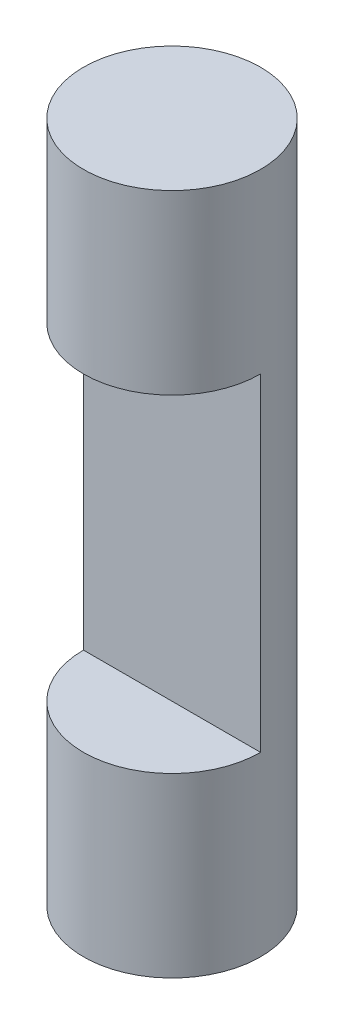
from build123d import *

# Parameters (mm, degrees)
SKETCH1_R           = 13
BOSS_EXTRUDE1_DEPTH = 1
SKETCH16_R          = 13
BOSS_EXTRUDE3_DEPTH = 1
SKETCH19_R          = 1
BOSS_EXTRUDE4_DEPTH = 29.8
SKETCH18_W          = 22
SKETCH18_H          = 22
CUT_EXTRUDE6_DEPTH  = 3.7
SKETCH21_R          = 11
CUT_EXTRUDE7_DEPTH  = 3.7
SKETCH22_R          = 11
CUT_EXTRUDE8_DEPTH  = 3.7
SKETCH23_R          = 11
CUT_EXTRUDE9_DEPTH  = 3.7
SKETCH24_R          = 19.921792127
CUT_EXTRUDE10_DEPTH = 1
SKETCH25_R          = 36.182885583
CUT_EXTRUDE11_DEPTH = 1
BOSS_EXTRUDE5_START = 2
BOSS_EXTRUDE5_DEPTH = 2
SKETCH27_R          = 1
BOSS_EXTRUDE6_DEPTH = 2
SKETCH28_R          = 15.857434306
CUT_EXTRUDE12_DEPTH = 26.1


with BuildPart() as part:
    # Sketch1 → Boss-Extrude1 (new body)
    with BuildSketch(Plane(origin=(0, 0, 0), x_dir=(1, 0, 0), z_dir=(0, 1, 0))):
        with Locations(Location((0, 0, 0), (0, 0, 270))):
            Circle(SKETCH1_R)
    extrude(amount=BOSS_EXTRUDE1_DEPTH)



with BuildPart() as body_2:
    # Sketch16 → Boss-Extrude3 (new body)
    with BuildSketch(Plane(origin=(0, 30.8, 0), x_dir=(1, 0, 0), z_dir=(0, 1, 0))):
        with Locations(Location((0, 0, 0), (0, 0, 270))):
            Circle(SKETCH16_R)
    extrude(amount=BOSS_EXTRUDE3_DEPTH)


with BuildPart() as part_1:
    add(part.part)

    add(body_2.part)  # Boss-Extrude4 merges body 2
    # Sketch19 → Boss-Extrude4 (add)
    with BuildSketch(Plane(origin=(0, 1, 0), x_dir=(1, 0, 0), z_dir=(0, 1, 0))):
        with Locations(Location((0, 11, 0), (0, 0, 270))):
            Circle(SKETCH19_R)
    extrude(amount=BOSS_EXTRUDE4_DEPTH)

    # Sketch18 → Cut-Extrude6 (cut)
    with BuildSketch(Plane(origin=(0, 4.7, 0), x_dir=(1, 0, 0), z_dir=(0, 1, 0))):
        Rectangle(SKETCH18_W, SKETCH18_H)
    extrude(amount=-CUT_EXTRUDE6_DEPTH, mode=Mode.SUBTRACT)

    # Sketch21 → Cut-Extrude7 (cut)
    with BuildSketch(Plane(origin=(0, 13.4, 0), x_dir=(1, 0, 0), z_dir=(0, 1, 0))):
        Circle(SKETCH21_R)
    extrude(amount=-CUT_EXTRUDE7_DEPTH, mode=Mode.SUBTRACT)

    # Sketch22 → Cut-Extrude8 (cut)
    with BuildSketch(Plane(origin=(0, 22.1, 0), x_dir=(1, 0, 0), z_dir=(0, 1, 0))):
        Circle(SKETCH22_R)
    extrude(amount=-CUT_EXTRUDE8_DEPTH, mode=Mode.SUBTRACT)

    # Sketch23 → Cut-Extrude9 (cut)
    with BuildSketch(Plane(origin=(0, 30.8, 0), x_dir=(1, 0, 0), z_dir=(0, 1, 0))):
        Circle(SKETCH23_R)
    extrude(amount=-CUT_EXTRUDE9_DEPTH, mode=Mode.SUBTRACT)

    # Sketch24 → Cut-Extrude10 (cut)
    with BuildSketch(Plane(origin=(0, 31.8, 0), x_dir=(1, 0, 0), z_dir=(0, 1, 0))):
        Circle(SKETCH24_R)
    extrude(amount=-CUT_EXTRUDE10_DEPTH, mode=Mode.SUBTRACT)

    # Sketch25 → Cut-Extrude11 (cut)
    with BuildSketch(Plane(origin=(0, 1, 0), x_dir=(1, 0, 0), z_dir=(0, 1, 0))):
        Circle(SKETCH25_R)
    extrude(amount=-CUT_EXTRUDE11_DEPTH, mode=Mode.SUBTRACT)

    # Sketch26 → Boss-Extrude5 (add)
    with BuildSketch(Plane(origin=(0, 30.8, 0), x_dir=(1, 0, 0), z_dir=(0, 1, 0)).offset(BOSS_EXTRUDE5_START)):
        with BuildLine():
            ThreePointArc((-0.998966408, 10.954545455), (0, 11), (0.998966408, 10.954545455))
            ThreePointArc((0.998966408, 10.954545455), (0, 12), (-0.998966408, 10.954545455))
        make_face()
        with BuildLine():
            ThreePointArc((0.998966408, 10.954545455), (0.999741569, 10.977266852), (1, 11))
            ThreePointArc((1, 11), (-0.022733148, 11.999741569), (-0.998966408, 10.954545455))
            ThreePointArc((-0.998966408, 10.954545455), (0, 11), (0.998966408, 10.954545455))
        make_face()
        with BuildLine():
            ThreePointArc((0.998966408, 10.954545455), (0, 11), (-0.998966408, 10.954545455))
            ThreePointArc((-0.998966408, 10.954545455), (0, 10), (0.998966408, 10.954545455))
        make_face()
    extrude(amount=-BOSS_EXTRUDE5_DEPTH)

    # Sketch27 → Boss-Extrude6 (add)
    with BuildSketch(Plane.XZ.offset(-1)):
        with Locations(Location((0, -11, 0), (0, 0, 270))):
            Circle(SKETCH27_R)
    extrude(amount=BOSS_EXTRUDE6_DEPTH)

    # Sketch28 → Cut-Extrude12 (cut)
    with BuildSketch(Plane(origin=(0, 32.8, 0), x_dir=(1, 0, 0), z_dir=(0, 1, 0))):
        with Locations((-0.375221001, 0)):
            Circle(SKETCH28_R)
    extrude(amount=-CUT_EXTRUDE12_DEPTH, mode=Mode.SUBTRACT)


solid = part_1.part
